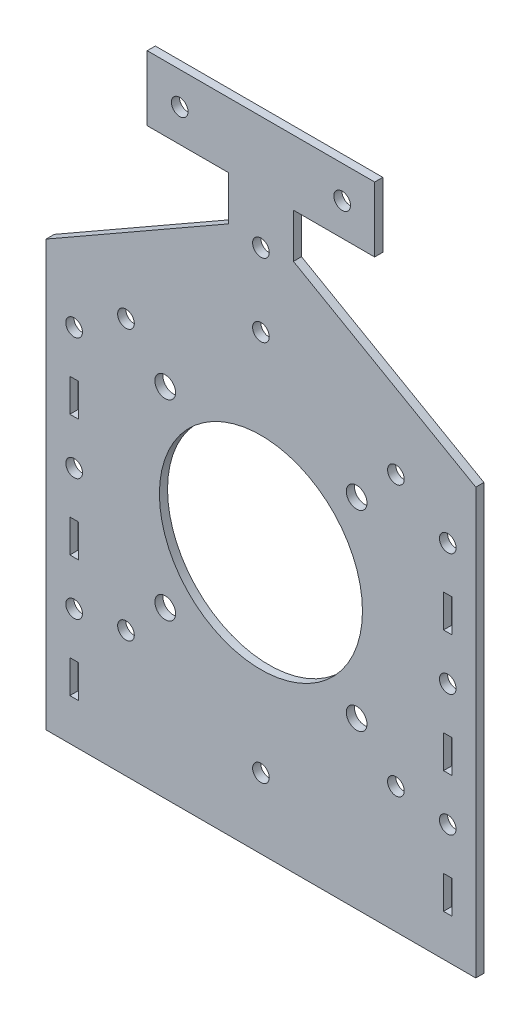
from build123d import *

# Parameters (mm, degrees)
SKETCH_1_R      = 2.55
SKETCH_1_R_2    = 25
SKETCH_1_R_3    = 2.05
SKETCH_1_W      = 2.1
SKETCH_1_H      = 8.1
EXTRUDE_1_DEPTH = 2


with BuildPart() as part:
    # 草图1 → 凸台-拉伸1 (new body)
    with BuildSketch(Plane.XY):
        Polygon((-52.9, 53.883164809), (-52.9, -50.790000001), (52.9, -50.790000001), (52.9, 53.883164809), (8, 79.569735886), (8, 90.5), (28, 90.5), (28, 106.5), (-28, 106.5), (-28, 90.5), (-8, 90.5), (-8, 79.569735886), align=None)
        with Locations((-23.57, 37.07)):
            Circle(SKETCH_1_R, mode=Mode.SUBTRACT)
        with Locations((-23.57, -10.07)):
            Circle(SKETCH_1_R, mode=Mode.SUBTRACT)
        with Locations((23.57, -10.07)):
            Circle(SKETCH_1_R, mode=Mode.SUBTRACT)
        with Locations((23.57, 37.07)):
            Circle(SKETCH_1_R, mode=Mode.SUBTRACT)
        with Locations((0, 13.5)):
            Circle(SKETCH_1_R_2, mode=Mode.SUBTRACT)
        with Locations((0, 60.5)):
            Circle(SKETCH_1_R_3, mode=Mode.SUBTRACT)
        with Locations((33.234018716, 46.734018716)):
            Circle(SKETCH_1_R_3, mode=Mode.SUBTRACT)
        with Locations((33.234018716, -19.734018716)):
            Circle(SKETCH_1_R_3, mode=Mode.SUBTRACT)
        with Locations((0, -33.5)):
            Circle(SKETCH_1_R_3, mode=Mode.SUBTRACT)
        with Locations((-33.234018716, -19.734018716)):
            Circle(SKETCH_1_R_3, mode=Mode.SUBTRACT)
        with Locations((-33.234018716, 46.734018716)):
            Circle(SKETCH_1_R_3, mode=Mode.SUBTRACT)
        with Locations((0, 78.5)):
            Circle(SKETCH_1_R_3, mode=Mode.SUBTRACT)
        with Locations((-20, 98.5)):
            Circle(SKETCH_1_R_3, mode=Mode.SUBTRACT)
        with Locations((20, 98.5)):
            Circle(SKETCH_1_R_3, mode=Mode.SUBTRACT)
        with Locations((-46, -21.5)):
            Circle(SKETCH_1_R_3, mode=Mode.SUBTRACT)
        with Locations((-46, 8.5)):
            Circle(SKETCH_1_R_3, mode=Mode.SUBTRACT)
        with Locations((46, 8.5)):
            Circle(SKETCH_1_R_3, mode=Mode.SUBTRACT)
        with Locations((46, -21.5)):
            Circle(SKETCH_1_R_3, mode=Mode.SUBTRACT)
        with Locations((-46, 38.5)):
            Circle(SKETCH_1_R_3, mode=Mode.SUBTRACT)
        with Locations((46, 38.5)):
            Circle(SKETCH_1_R_3, mode=Mode.SUBTRACT)
        with Locations((-46, -36.5)):
            Rectangle(SKETCH_1_W, SKETCH_1_H, mode=Mode.SUBTRACT)
        with Locations((-46, -6.5)):
            Rectangle(SKETCH_1_W, SKETCH_1_H, mode=Mode.SUBTRACT)
        with Locations((-46, 23.5)):
            Rectangle(SKETCH_1_W, SKETCH_1_H, mode=Mode.SUBTRACT)
        with Locations((46, 23.5)):
            Rectangle(SKETCH_1_W, SKETCH_1_H, mode=Mode.SUBTRACT)
        with Locations((46, -6.5)):
            Rectangle(SKETCH_1_W, SKETCH_1_H, mode=Mode.SUBTRACT)
        with Locations((46, -36.5)):
            Rectangle(SKETCH_1_W, SKETCH_1_H, mode=Mode.SUBTRACT)
    extrude(amount=EXTRUDE_1_DEPTH)


solid = part.part
